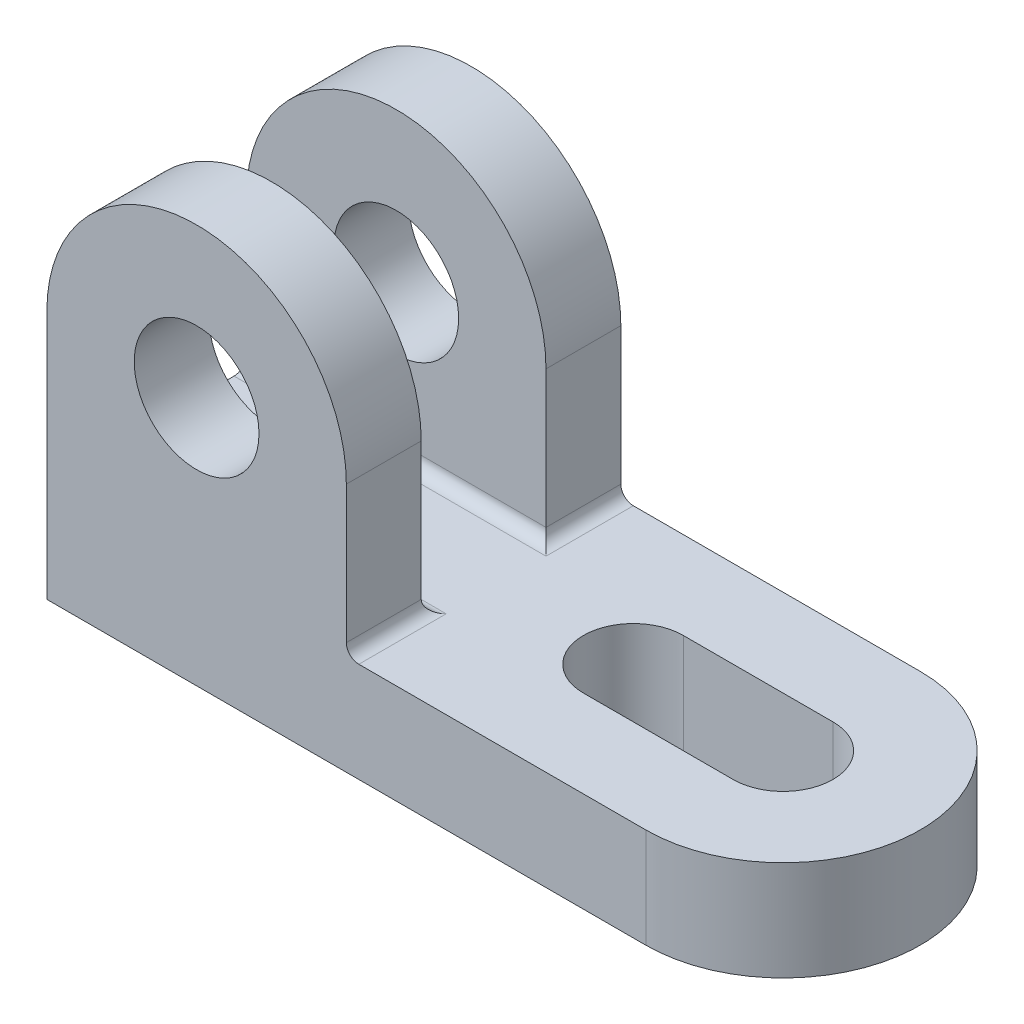
from build123d import *

# Parameters (mm, degrees)
SKETCH2_R           = 22
BOSS_EXTRUDE2_DEPTH = 16
CUT_EXTRUDE1_DEPTH  = 16
BOSS_EXTRUDE3_DEPTH = 12
FILLET1_R           = 2


with BuildPart() as part:
    # Sketch2 → Boss-Extrude2 (new body)
    with BuildSketch(Plane(origin=(0, 0, 0), x_dir=(1, 0, 0), z_dir=(0, 1, 0))):
        with BuildLine():
            Line((37, 22), (-59, 22))
            Line((-59, 22), (-59, -22))
            Line((-59, -22), (37, -22))
            ThreePointArc((37, -22), (15, 0), (37, 22))
        make_face()
        with Locations((37, 0)):
            Circle(SKETCH2_R)
    extrude(amount=BOSS_EXTRUDE2_DEPTH)

    # Sketch3 → Cut-Extrude1 (cut)
    with BuildSketch(Plane(origin=(0, 16, 0), x_dir=(1, 0, 0), z_dir=(0, 1, 0))):
        with BuildLine():
            Line((37, -8), (13, -8))
            ThreePointArc((13, -8), (5, 0), (13, 8))
            Line((13, 8), (37, 8))
            ThreePointArc((37, 8), (45, 0), (37, -8))
        make_face()
    extrude(amount=-CUT_EXTRUDE1_DEPTH, mode=Mode.SUBTRACT)

    # Sketch4 → Boss-Extrude3 (add)
    with BuildSketch(Plane.XY.offset(22)):
        with BuildLine():
            ThreePointArc((-11, 40), (-18.029437232, 23.029437271), (-34.999999946, 16))
            Line((-34.999999946, 16), (-11, 16))
            Line((-11, 16), (-11, 40))
        make_face()
        with BuildLine():
            Line((-59, 40), (-59, 16))
            Line((-59, 16), (-34.999999946, 16))
            ThreePointArc((-34.999999946, 16), (-51.970562729, 23.029437232), (-59, 40))
        make_face()
        with BuildLine():
            ThreePointArc((-59, 40), (-51.970562729, 23.029437232), (-34.999999946, 16))
            ThreePointArc((-34.999999946, 16), (-18.029437232, 23.029437271), (-11, 40))
            Line((-11, 40), (-25, 40))
            ThreePointArc((-25, 40), (-35, 30), (-45, 40))
            Line((-45, 40), (-59, 40))
        make_face()
        with BuildLine():
            ThreePointArc((-11, 40), (-35, 64), (-59, 40))
            Line((-59, 40), (-45, 40))
            ThreePointArc((-45, 40), (-35, 50), (-25, 40))
            Line((-25, 40), (-11, 40))
        make_face()
    boss_extrude3 = extrude(amount=-BOSS_EXTRUDE3_DEPTH)

    # Mirror1: Boss-Extrude3 across plane
    add(boss_extrude3.mirror(Plane.XY))

    # Fillet1
    fillet1_edges = [part.edges().sort_by_distance(p)[0] for p in [
        (-11, 16, 16),
        (-35, 16, 10),
        (-11, 16, -16),
        (-35, 16, -10),
    ]]
    fillet(fillet1_edges, radius=FILLET1_R)


solid = part.part
